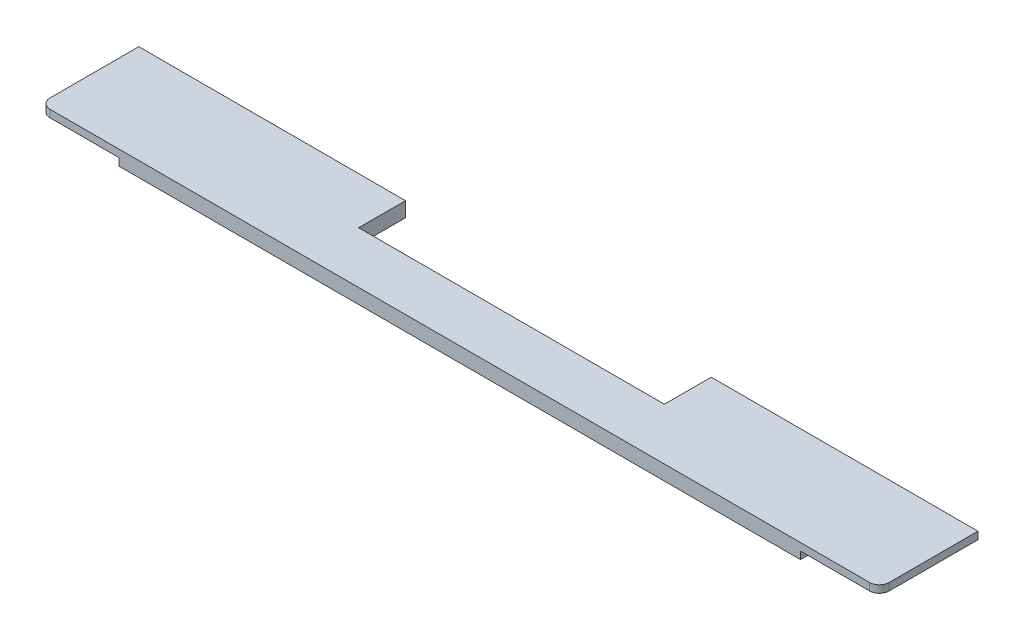
from build123d import *

# Parameters (mm, degrees)
SKETCH_1_W          = 138.2
SKETCH_1_H          = 20
EXTRUDE_1_DEPTH     = 3
SKETCH_2_W          = 62
SKETCH_2_H          = 9.5
CUT_EXTRUDE_1_DEPTH = 3
SKETCH_3_W          = 16
SKETCH_3_H          = 20
EXTRUDE_2_DEPTH     = 1.5
FILLET_1_R          = 2


with BuildPart() as part:
    # 草图1 → 凸台-拉伸1 (new body)
    with BuildSketch(Plane(origin=(0, 0, 0), x_dir=(1, 0, 0), z_dir=(0, 1, 0))):
        with Locations((69.1, 10)):
            Rectangle(SKETCH_1_W, SKETCH_1_H)
    extrude(amount=EXTRUDE_1_DEPTH)

    # 草图2 → 切除-拉伸1 (cut)
    with BuildSketch(Plane(origin=(0, 3, 0), x_dir=(1, 0, 0), z_dir=(0, 1, 0))):
        with Locations((69.1, 15.25)):
            Rectangle(SKETCH_2_W, SKETCH_2_H)
    extrude(amount=-CUT_EXTRUDE_1_DEPTH, mode=Mode.SUBTRACT)

    # 草图3 → 凸台-拉伸2 (add)
    with BuildSketch(Plane(origin=(0, 3, 0), x_dir=(1, 0, 0), z_dir=(0, 1, 0))):
        with Locations((146.2, 10)):
            Rectangle(SKETCH_3_W, SKETCH_3_H)
        with Locations((-8, 10)):
            Rectangle(SKETCH_3_W, SKETCH_3_H)
    extrude(amount=-EXTRUDE_2_DEPTH)

    # 圆角1
    fillet_1_edges = [part.edges().sort_by_distance(p)[0] for p in [
        (154.2, 2.25, 0),
        (-16, 2.25, 0),
    ]]
    fillet(fillet_1_edges, radius=FILLET_1_R)


solid = part.part
